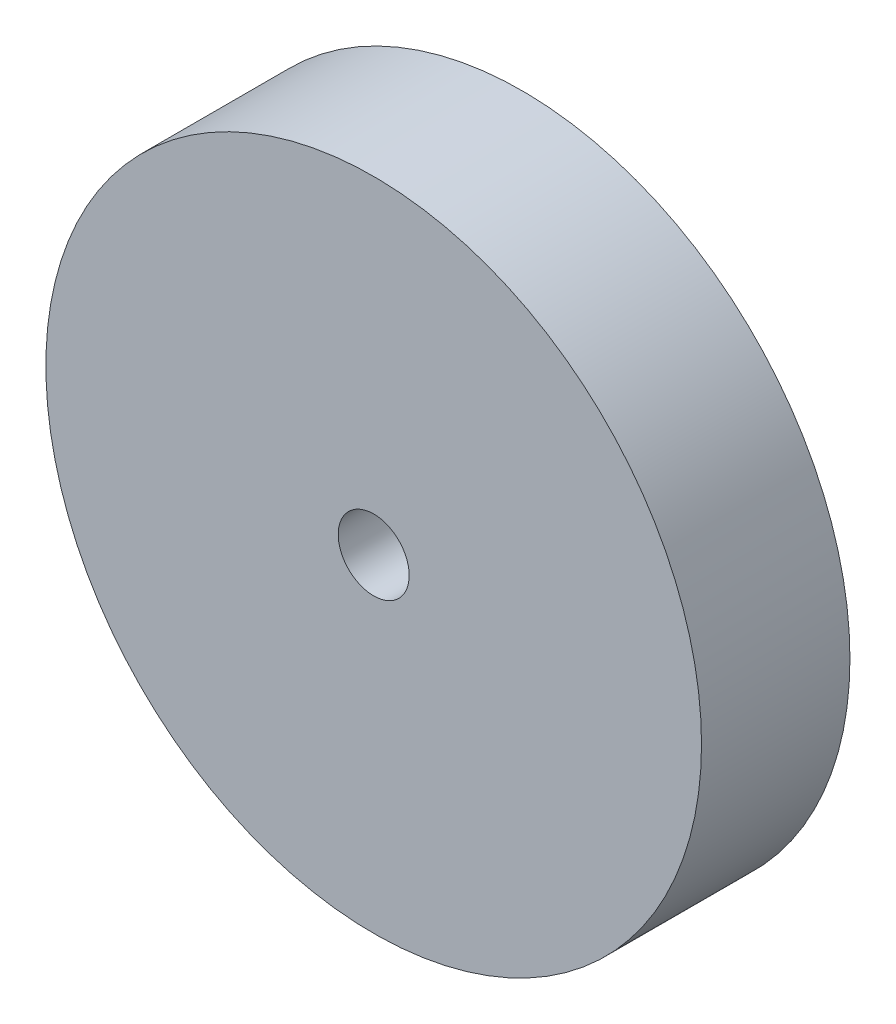
from build123d import *

# Parameters (mm, degrees)
SKETCH_1_R      = 50.8
SKETCH_1_R_2    = 5.5
EXTRUDE_1_DEPTH = 11.5


with BuildPart() as part:
    # 草图1 → 凸台-拉伸1 (new, symmetric)
    with BuildSketch(Plane.XY):
        Circle(SKETCH_1_R)
        Circle(SKETCH_1_R_2, mode=Mode.SUBTRACT)
    extrude(amount=EXTRUDE_1_DEPTH, both=True)


solid = part.part
